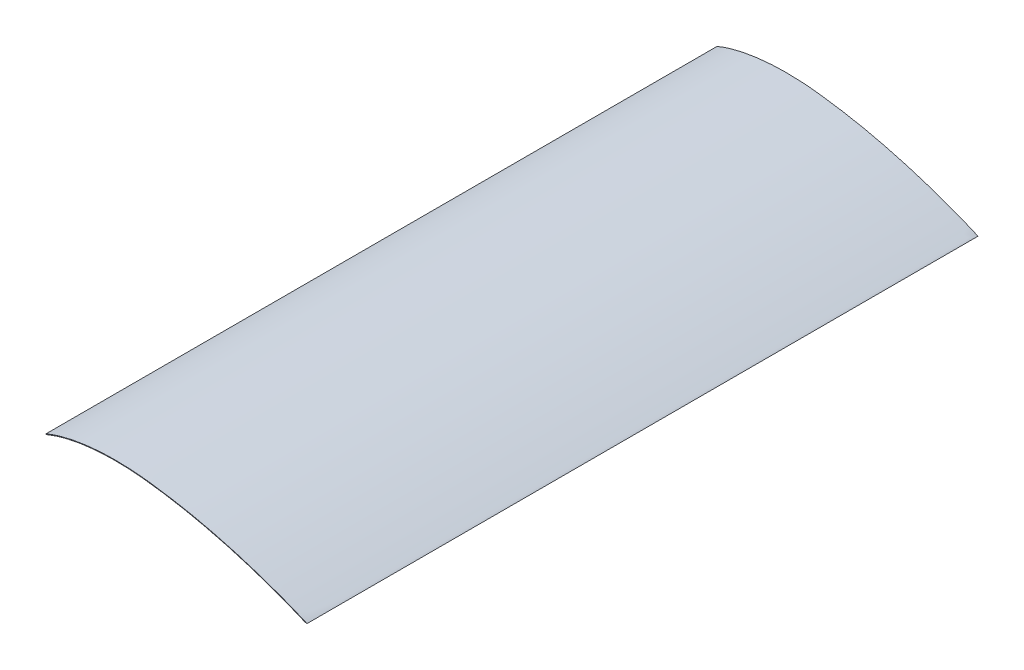
from build123d import *

# Parameters (mm, degrees)
BOSS_EXTRUDE1_DEPTH = 895.35


with BuildPart() as part:
    # Sketch1 → Boss-Extrude1 (new body)
    with BuildSketch(Plane.XY):
        with BuildLine():
            Line((1922.747404436, 3204.34789867), (1922.491055138, 3205.066947575))
            add(Edge.make_bspline(
                [(2270.77788467, 3159.896636166), (2270.75441769, 3159.911438559), (2270.636956566, 3159.96239267), (2270.365758628, 3160.069260164), (2269.9390685, 3160.263066408), (2269.326994037, 3160.500679536), (2268.571678874, 3160.862006068), (2267.609403683, 3161.246948178), (2266.502697643, 3161.7510558), (2265.199998994, 3162.263777052), (2263.758257646, 3162.909203391), (2262.121148449, 3163.56415045), (2260.335663435, 3164.330180408), (2258.364075089, 3165.127187939), (2256.260773505, 3166.035665928), (2253.963070669, 3166.912498705), (2251.54387421, 3167.927057581), (2248.937413573, 3168.936879873), (2246.19850546, 3170.089522012), (2243.266276854, 3171.201431104), (2240.199428489, 3172.376797798), (2237.002582412, 3173.630676685), (2233.625139232, 3174.838033589), (2230.13801904, 3176.178132259), (2226.50130882, 3177.511139969), (2222.723089138, 3178.846600297), (2218.804297413, 3180.232565804), (2214.765883399, 3181.684465226), (2210.573627804, 3183.066072392), (2206.286835148, 3184.540645895), (2201.862173415, 3185.990737499), (2197.31900002, 3187.463651633), (2192.674162708, 3188.934089627), (2187.923208653, 3190.4275983), (2183.073560647, 3191.919319434), (2178.102280878, 3193.373369431), (2173.055334375, 3194.851143258), (2167.908219033, 3196.27713073), (2162.681600539, 3197.723335551), (2157.388152391, 3199.184477504), (2151.986945432, 3200.552493603), (2146.530369861, 3201.929210939), (2141.023660126, 3203.339947561), (2135.447506321, 3204.646528141), (2129.825654619, 3205.935887744), (2124.134033748, 3207.175611417), (2118.417844004, 3208.450512256), (2112.646315414, 3209.617255464), (2106.858420898, 3210.786907026), (2101.026287418, 3211.831514671), (2095.198146734, 3212.933419373), (2089.345125675, 3213.94163165), (2083.479198618, 3214.836607078), (2077.619521137, 3215.819859622), (2071.742674986, 3216.583849905), (2065.89798829, 3217.450687566), (2060.055602465, 3218.126397882), (2054.216975829, 3218.799164119), (2048.364988519, 3219.448376938), (2042.501692376, 3219.968704421), (2036.655202392, 3220.364613924), (2030.841981883, 3220.713839071), (2025.081697786, 3220.91509423), (2019.3778707, 3221.069638567), (2013.753478196, 3221.07765753), (2008.183752848, 3221.033537028), (2002.707213115, 3220.85332481), (1997.310940322, 3220.597278132), (1992.008104186, 3220.260826383), (1986.797861054, 3219.852817682), (1981.694452831, 3219.350292595), (1976.708204622, 3218.773648921), (1971.844266562, 3218.103729377), (1967.094011039, 3217.401145232), (1962.476026682, 3216.615314191), (1957.995010392, 3215.730766723), (1953.653778705, 3214.811833009), (1949.45954354, 3213.838476011), (1945.417798034, 3212.835438723), (1941.53936578, 3211.737037925), (1937.786225658, 3210.701813129), (1934.224275186, 3209.52008652), (1930.823493137, 3208.338736032), (1927.577460883, 3207.175361303), (1924.832447032, 3206.042445978), (1923.151769306, 3205.348165568), (1922.491055138, 3205.066947575)],
                knots=[0, 0, 0, 0, 0.003264659, 0.015304128, 0.034284128, 0.058758187, 0.092935911, 0.133105815, 0.181130717, 0.236533822, 0.298407512, 0.367661393, 0.444765429, 0.527870086, 0.618824688, 0.715328369, 0.81828684, 0.92864005, 1.045449174, 1.16921378, 1.298989631, 1.433381025, 1.574767534, 1.722581268, 1.874596647, 2.032229325, 2.195879631, 2.365547713, 2.539066732, 2.717192715, 2.900973024, 3.089001526, 3.281284136, 3.476405912, 3.677212977, 3.88054648, 4.088159302, 4.298328318, 4.511358278, 4.728682601, 4.946892776, 5.169412295, 5.393368872, 5.618270486, 5.845824496, 6.07460235, 6.306268974, 6.537530393, 6.77005115, 7.003673961, 7.237296773, 7.470609158, 7.705101703, 7.93813984, 8.172291252, 8.404986123, 8.63596163, 8.866867911, 9.099173136, 9.331354453, 9.562034453, 9.791273051, 10.019150008, 10.242763677, 10.465163421, 10.683407784, 10.900594746, 11.112294746, 11.321462358, 11.528149067, 11.729528535, 11.927109208, 12.120959605, 12.309407094, 12.494251397, 12.674163447, 12.848839497, 13.018331601, 13.182696738, 13.340619884, 13.494419641, 13.64244953, 13.783738008, 13.919674906, 14.049614906, 14.134429208, 14.134429208, 14.134429208, 14.134429208], degree=3))
            Line((2270.77788467, 3159.896636166), (2268.025201292, 3160.257209437))
            add(Edge.make_bspline(
                [(2268.025201292, 3160.257209437), (2267.512891672, 3160.483623228), (2266.963168495, 3160.708772836), (2265.823632187, 3161.204140196), (2265.17239828, 3161.456507564), (2263.882746678, 3162.012733754), (2263.263958712, 3162.280482959), (2261.284641105, 3163.090368213), (2259.950300306, 3163.656512114), (2257.258583453, 3164.767051883), (2255.944744928, 3165.328649537), (2253.242950329, 3166.388505955), (2251.900880051, 3166.953961544), (2249.214953829, 3168.020363319), (2247.854429692, 3168.574903472), (2245.184189789, 3169.662166584), (2243.836650438, 3170.169663282), (2239.684219999, 3171.755929486), (2236.916923612, 3172.833982345), (2231.285987553, 3174.897677952), (2228.504256584, 3175.976725628), (2222.88339779, 3177.990012229), (2220.054128143, 3178.982328309), (2211.495825188, 3182.033623644), (2205.709480757, 3183.940794543), (2194.106500319, 3187.703788589), (2188.290969077, 3189.552686331), (2176.617229485, 3193.041315023), (2170.74733688, 3194.701172294), (2160.046359368, 3197.661438383), (2155.231231261, 3198.94582805), (2145.535189561, 3201.396076204), (2140.702423782, 3202.638492988), (2130.969441925, 3204.900474042), (2126.085955186, 3205.9733828), (2116.327719141, 3208.118908297), (2111.43190678, 3209.120700448), (2101.633928691, 3210.981091523), (2096.707685449, 3211.902708018), (2086.872395933, 3213.582286656), (2081.922646753, 3214.386319438), (2072.880848724, 3215.704397122), (2068.730490134, 3216.297653536), (2060.472602017, 3217.33768525), (2056.314293276, 3217.799071214), (2048.024725921, 3218.716081538), (2043.883260858, 3219.09841811), (2035.568453506, 3219.679664478), (2031.409973059, 3219.926896814), (2019.381081796, 3220.351440368), (2011.515106806, 3220.40941425), (1989.640962803, 3219.588386684), (1975.628129964, 3218.293749774), (1948.512773217, 3213.195478423), (1935.250781773, 3209.669685543), (1922.789476802, 3204.365813843), (1922.775451669, 3204.359844363), (1922.761427551, 3204.353872631), (1922.747404436, 3204.34789867)],
                knots=[0.105061788, 0.105061788, 0.105061788, 0.105061788, 0.17271968, 0.17271968, 0.254746022, 0.254746022, 0.336772365, 0.336772365, 0.507993709, 0.507993709, 0.679215053, 0.679215053, 0.850436398, 0.850436398, 1.021657742, 1.021657742, 1.192879086, 1.192879086, 1.546135238, 1.546135238, 1.89939139, 1.89939139, 2.252647542, 2.252647542, 2.973527292, 2.973527292, 3.694407042, 3.694407042, 4.415286791, 4.415286791, 5.005865709, 5.005865709, 5.596444628, 5.596444628, 6.187023546, 6.187023546, 6.777602464, 6.777602464, 7.368181383, 7.368181383, 7.958760301, 7.958760301, 8.451933288, 8.451933288, 8.945106275, 8.945106275, 9.438279262, 9.438279262, 9.931452248, 9.931452248, 10.86258241, 10.86258241, 12.522647589, 12.522647589, 14.134429208, 14.134429208, 14.134429208, 14.13624326, 14.13624326, 14.13624326, 14.13624326], degree=3))
        make_face()
    extrude(amount=BOSS_EXTRUDE1_DEPTH)


solid = part.part
